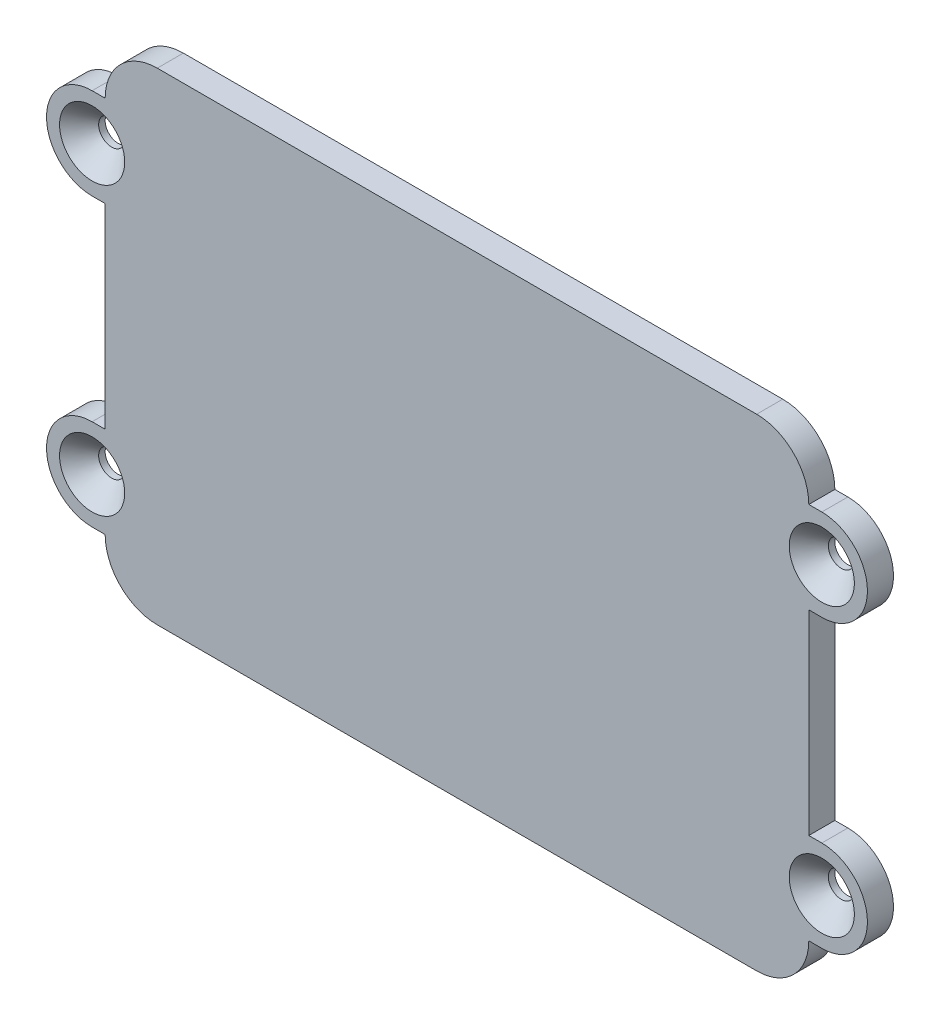
from build123d import *

# Parameters (mm, degrees)
SCHIZZO1_R                   = 1
ESTRUSIONE_ESTRUSIONE1_DEPTH = 2
SMUSSO1_SIZE                 = 1.5


with BuildPart() as part:
    # Schizzo1 → Estrusione-Estrusione1 (new body)
    with BuildSketch(Plane.XY):
        with BuildLine():
            Line((-23, -18.5), (23, -18.5))
            ThreePointArc((23, -18.5), (25.828427125, -17.328427125), (27, -14.5))
            Line((27, -14.5), (28, -14.5))
            ThreePointArc((28, -14.5), (31.5, -11), (28, -7.5))
            Line((28, -7.5), (27, -7.5))
            Line((27, -7.5), (27, 7.5))
            Line((27, 7.5), (28, 7.5))
            ThreePointArc((28, 7.5), (31.5, 11), (28, 14.5))
            Line((28, 14.5), (27, 14.5))
            ThreePointArc((27, 14.5), (25.828427125, 17.328427125), (23, 18.5))
            Line((23, 18.5), (-23, 18.5))
            ThreePointArc((-23, 18.5), (-25.828427125, 17.328427125), (-27, 14.5))
            Line((-27, 14.5), (-28, 14.5))
            ThreePointArc((-28, 14.5), (-31.5, 11), (-28, 7.5))
            Line((-28, 7.5), (-27, 7.5))
            Line((-27, 7.5), (-27, -7.5))
            Line((-27, -7.5), (-28, -7.5))
            ThreePointArc((-28, -7.5), (-31.5, -11), (-28, -14.5))
            Line((-28, -14.5), (-27, -14.5))
            ThreePointArc((-27, -14.5), (-25.828427125, -17.328427125), (-23, -18.5))
        make_face()
        with Locations((-28, 11)):
            Circle(SCHIZZO1_R, mode=Mode.SUBTRACT)
        with Locations((-28, -11)):
            Circle(SCHIZZO1_R, mode=Mode.SUBTRACT)
        with Locations((28, -11)):
            Circle(SCHIZZO1_R, mode=Mode.SUBTRACT)
        with Locations((28, 11)):
            Circle(SCHIZZO1_R, mode=Mode.SUBTRACT)
    extrude(amount=ESTRUSIONE_ESTRUSIONE1_DEPTH)

    # Smusso1
    smusso1_edges = [part.edges().sort_by_distance(p)[0] for p in [
        (-29, 11, 2),
        (-29, -11, 2),
        (27, -11, 2),
        (27, 11, 2),
    ]]
    chamfer(smusso1_edges, length=SMUSSO1_SIZE)


solid = part.part
